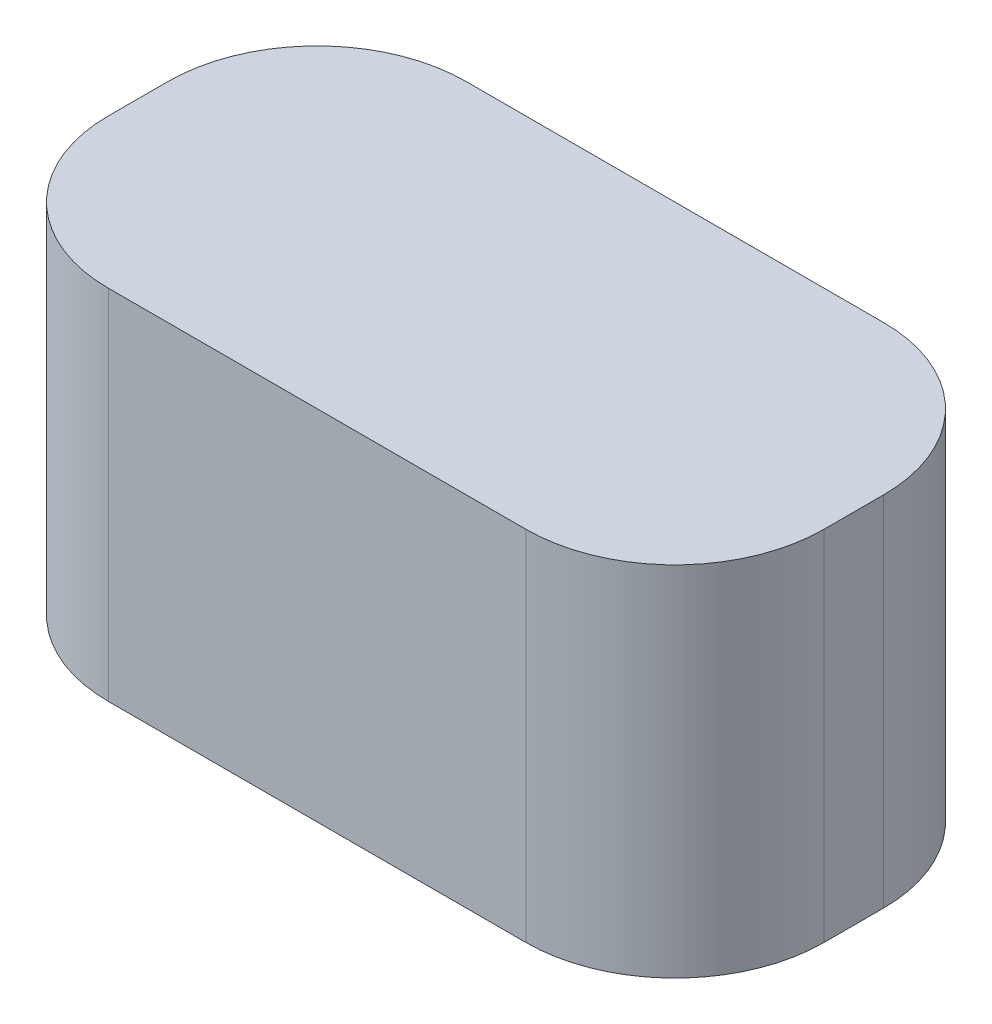
from build123d import *

# Parameters (mm, degrees)
RESSALTO_EXTRUS_O1_DEPTH = 12


with BuildPart() as part:
    # Esboço1 → Ressalto-extrusão1 (new body)
    with BuildSketch(Plane(origin=(0, 0, 0), x_dir=(1, 0, 0), z_dir=(0, 1, 0))):
        with BuildLine():
            Line((-31.921481623, -15.403780026), (-17.921481623, -15.403780026))
            ThreePointArc((-17.921481623, -15.403780026), (-14.385947717, -13.939313932), (-12.921481623, -10.403780026))
            Line((-12.921481623, -10.403780026), (-12.921481623, -8.403780026))
            ThreePointArc((-12.921481623, -8.403780026), (-14.385947717, -4.86824612), (-17.921481623, -3.403780026))
            Line((-17.921481623, -3.403780026), (-31.921481623, -3.403780026))
            ThreePointArc((-31.921481623, -3.403780026), (-35.457015529, -4.86824612), (-36.921481623, -8.403780026))
            Line((-36.921481623, -8.403780026), (-36.921481623, -10.403780026))
            ThreePointArc((-36.921481623, -10.403780026), (-35.457015529, -13.939313932), (-31.921481623, -15.403780026))
        make_face()
    extrude(amount=RESSALTO_EXTRUS_O1_DEPTH)


solid = part.part
